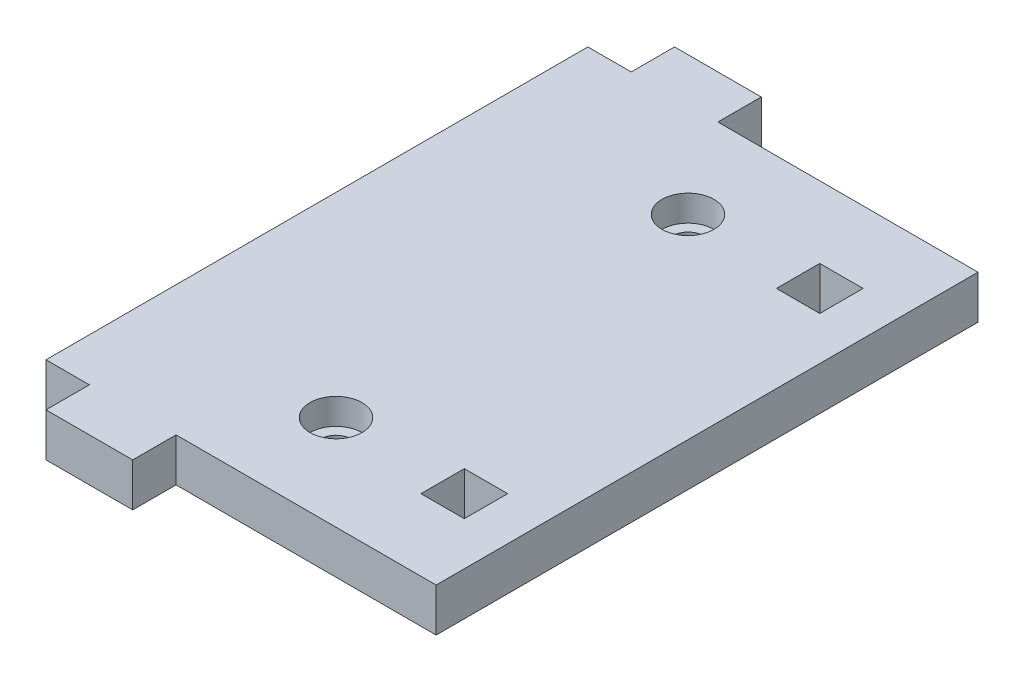
from build123d import *

# Parameters (mm, degrees)
SKETCH1_R           = 1.75
SKETCH1_W           = 5
SKETCH1_H           = 5
SKETCH1_W_2         = 10
BOSS_EXTRUDE1_DEPTH = 5
SKETCH2_R           = 3
CUT_EXTRUDE1_DEPTH  = 3


with BuildPart() as part:
    # Sketch1 → Boss-Extrude1 (new body)
    # profile 1 of 4: a face of its own
    with BuildSketch(Plane(origin=(0, 0, 0), x_dir=(1, 0, 0), z_dir=(0, 1, 0))):
        Polygon((-21.909620991, 19.482507289), (-21.909620991, -11.767492711), (23.090379009, -11.767492711), (23.090379009, 19.482507289), (-6.909620991, 19.482507289), (-16.909620991, 19.482507289), align=None)
        with Locations(Location((0.590379009, 8.532507289, 0), (0, 0, 270))):
            Circle(SKETCH1_R, mode=Mode.SUBTRACT)
        with Locations((15.590379009, 8.732507289)):
            Rectangle(SKETCH1_W, SKETCH1_H, mode=Mode.SUBTRACT)
    # profile 2 of 4: a face of its own
    with BuildSketch(Plane(origin=(0, 0, 0), x_dir=(1, 0, 0), z_dir=(0, 1, 0))):
        Polygon((23.090379009, -11.767492711), (-21.909620991, -11.767492711), (-21.909620991, -43.017492711), (-16.909620991, -43.017492711), (-6.909620991, -43.017492711), (23.090379009, -43.017492711), align=None)
        with Locations(Location((0.590379009, -32.067492711, 0), (0, 0, 270))):
            Circle(SKETCH1_R, mode=Mode.SUBTRACT)
        with Locations((15.590379009, -32.267492711)):
            Rectangle(SKETCH1_W, SKETCH1_H, mode=Mode.SUBTRACT)
    # profile 3 of 4: a face of its own
    with BuildSketch(Plane(origin=(0, 0, 0), x_dir=(1, 0, 0), z_dir=(0, 1, 0))):
        with Locations((-11.909620991, -45.517492711)):
            Rectangle(SKETCH1_W_2, SKETCH1_H)
    # profile 4 of 4: a face of its own
    with BuildSketch(Plane(origin=(0, 0, 0), x_dir=(1, 0, 0), z_dir=(0, 1, 0))):
        with Locations((-11.909620991, 21.982507289)):
            Rectangle(SKETCH1_W_2, SKETCH1_H)
    extrude(amount=BOSS_EXTRUDE1_DEPTH)

    # Sketch2 → Cut-Extrude1 (cut)
    with BuildSketch(Plane(origin=(0, 5, 0), x_dir=(1, 0, 0), z_dir=(0, 1, 0))):
        with Locations(Location((0.590379009, -32.067492711, 0), (0, 0, 270))):
            Circle(SKETCH2_R)
        with Locations(Location((0.590379009, 8.532507289, 0), (0, 0, 270))):
            Circle(SKETCH2_R)
    extrude(amount=-CUT_EXTRUDE1_DEPTH, mode=Mode.SUBTRACT)


solid = part.part
